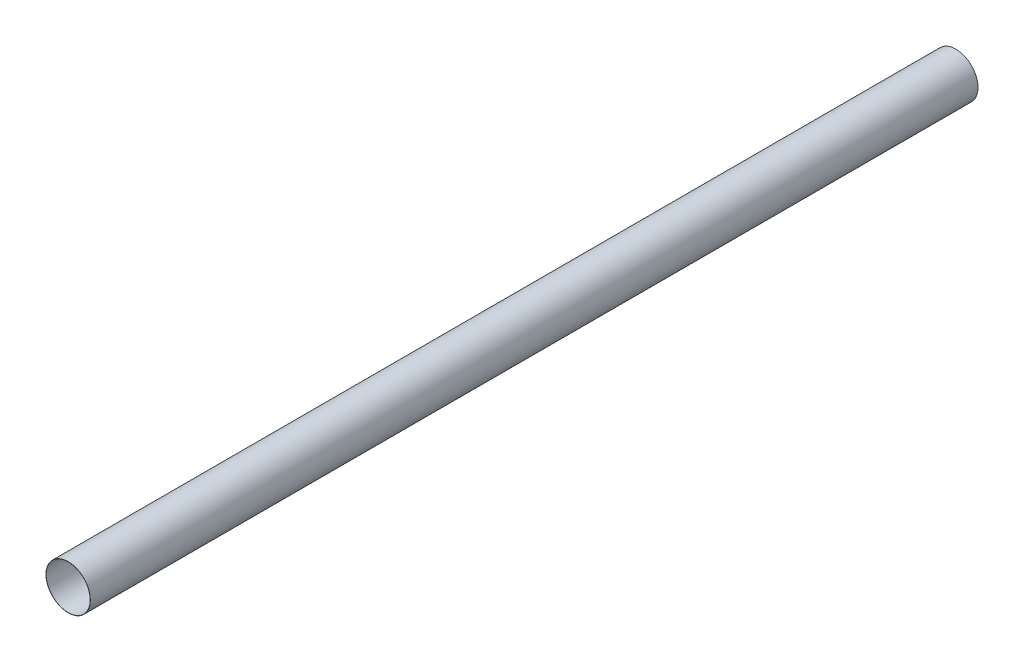
from build123d import *

# Parameters (mm, degrees)
SKETCH1_R           = 250
SKETCH1_R_2         = 248
BOSS_EXTRUDE1_DEPTH = 10000


with BuildPart() as part:
    # Sketch1 → Boss-Extrude1 (new body)
    with BuildSketch(Plane.XY):
        Circle(SKETCH1_R)
        Circle(SKETCH1_R_2, mode=Mode.SUBTRACT)
    extrude(amount=BOSS_EXTRUDE1_DEPTH)


solid = part.part
